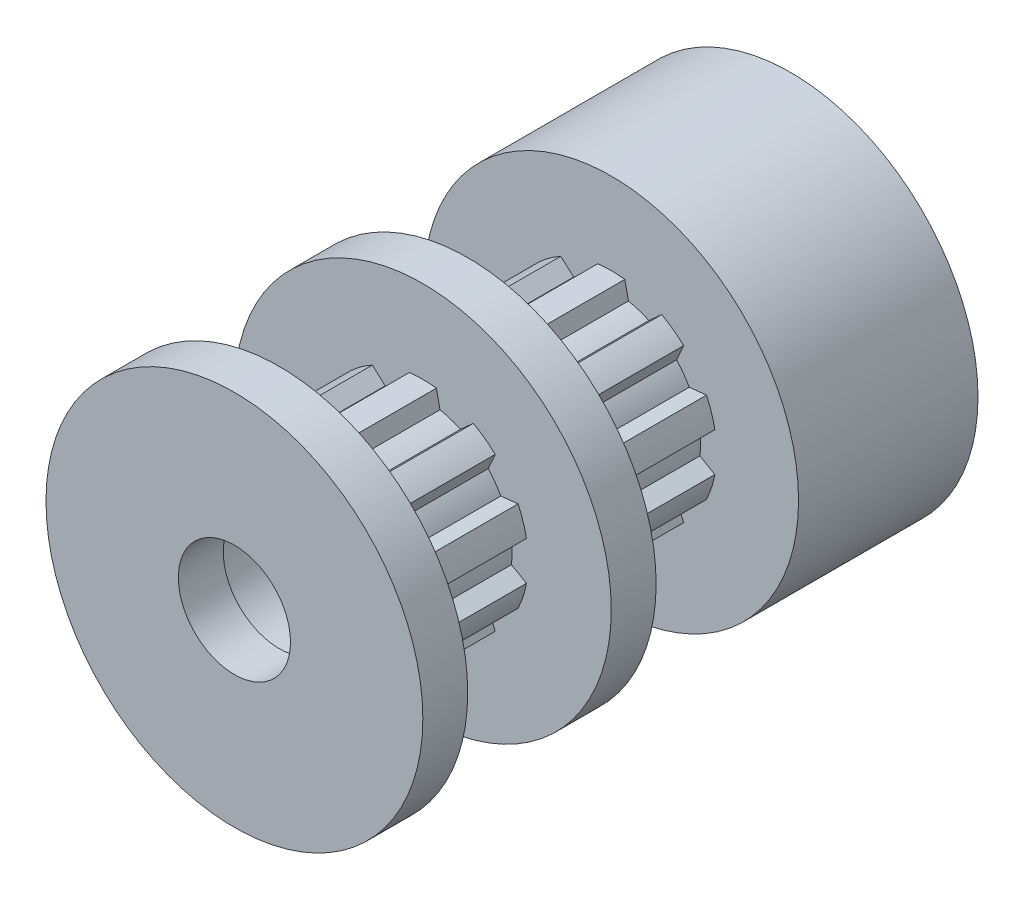
from build123d import *

# Parameters (mm, degrees)
SKETCH1_R           = 1.7653
BOSS_EXTRUDE1_DEPTH = 9.398
SKETCH2_R           = 5.334
SKETCH2_R_2         = 1.5875
BOSS_EXTRUDE2_DEPTH = 1.27
BOSS_EXTRUDE3_START = -1.27
SKETCH3_R           = 5.334
SKETCH3_R_2         = 1.5875
BOSS_EXTRUDE3_DEPTH = 1.27
SKETCH4_R           = 5.302265601
BOSS_EXTRUDE4_DEPTH = 5.08
SKETCH5_R           = 1.016
CUT_EXTRUDE1_DEPTH  = 7.62
SKETCH7_R           = 1.5875
CUT_EXTRUDE3_DEPTH  = 18.461460878


with BuildPart() as part:
    # Sketch1 → Boss-Extrude1 (new body)
    with BuildSketch(Plane.XY.offset(7.9502)):
        with BuildLine():
            Line((-2.508852776, -0.3048), (-2.933400151, -0.549912542))
            ThreePointArc((-2.933400151, -0.549912542), (-2.838428173, -0.92226122), (-2.696401056, -1.279320756))
            Line((-2.696401056, -1.279320756), (-2.208861477, -1.228078282))
            ThreePointArc((-2.208861477, -1.228078282), (-2.04462865, -1.485509668), (-1.850547587, -1.721255042))
            Line((-1.850547587, -1.721255042), (-2.049940092, -2.169097939))
            ThreePointArc((-2.049940092, -2.169097939), (-1.754245085, -2.41451122), (-1.429468404, -2.619897008))
            Line((-1.429468404, -2.619897008), (-1.06516017, -2.291872401))
            ThreePointArc((-1.06516017, -2.291872401), (-0.78097865, -2.403605134), (-0.485396118, -2.480249161))
            Line((-0.485396118, -2.480249161), (-0.383472592, -2.959761649))
            ThreePointArc((-0.383472592, -2.959761649), (0, -2.9845), (0.383472592, -2.959761649))
            Line((0.383472592, -2.959761649), (0.485396118, -2.480249161))
            ThreePointArc((0.485396118, -2.480249161), (0.78097865, -2.403605134), (1.06516017, -2.291872401))
            Line((1.06516017, -2.291872401), (1.429468404, -2.619897008))
            ThreePointArc((1.429468404, -2.619897008), (1.754245085, -2.41451122), (2.049940092, -2.169097939))
            Line((2.049940092, -2.169097939), (1.850547587, -1.721255042))
            ThreePointArc((1.850547587, -1.721255042), (2.04462865, -1.485509668), (2.208861477, -1.228078282))
            Line((2.208861477, -1.228078282), (2.696401056, -1.279320756))
            ThreePointArc((2.696401056, -1.279320756), (2.838428173, -0.92226122), (2.933400151, -0.549912542))
            Line((2.933400151, -0.549912542), (2.508852776, -0.3048))
            ThreePointArc((2.508852776, -0.3048), (2.5273, 0), (2.508852776, 0.3048))
            Line((2.508852776, 0.3048), (2.933400151, 0.549912542))
            ThreePointArc((2.933400151, 0.549912542), (2.838428173, 0.92226122), (2.696401056, 1.279320756))
            Line((2.696401056, 1.279320756), (2.208861477, 1.228078282))
            ThreePointArc((2.208861477, 1.228078282), (2.04462865, 1.485509668), (1.850547587, 1.721255042))
            Line((1.850547587, 1.721255042), (2.049940092, 2.169097939))
            ThreePointArc((2.049940092, 2.169097939), (1.754245085, 2.41451122), (1.429468404, 2.619897008))
            Line((1.429468404, 2.619897008), (1.06516017, 2.291872401))
            ThreePointArc((1.06516017, 2.291872401), (0.78097865, 2.403605134), (0.485396118, 2.480249161))
            Line((0.485396118, 2.480249161), (0.383472592, 2.959761649))
            ThreePointArc((0.383472592, 2.959761649), (0, 2.9845), (-0.383472592, 2.959761649))
            Line((-0.383472592, 2.959761649), (-0.485396118, 2.480249161))
            ThreePointArc((-0.485396118, 2.480249161), (-0.78097865, 2.403605134), (-1.06516017, 2.291872401))
            Line((-1.06516017, 2.291872401), (-1.429468404, 2.619897008))
            ThreePointArc((-1.429468404, 2.619897008), (-1.754245085, 2.41451122), (-2.049940092, 2.169097939))
            Line((-2.049940092, 2.169097939), (-1.850547587, 1.721255042))
            ThreePointArc((-1.850547587, 1.721255042), (-2.04462865, 1.485509668), (-2.208861477, 1.228078282))
            Line((-2.208861477, 1.228078282), (-2.696401056, 1.279320756))
            ThreePointArc((-2.696401056, 1.279320756), (-2.838428173, 0.92226122), (-2.933400151, 0.549912542))
            Line((-2.933400151, 0.549912542), (-2.508852776, 0.3048))
            ThreePointArc((-2.508852776, 0.3048), (-2.5273, 0), (-2.508852776, -0.3048))
        make_face()
        with Locations(Location((0, 0, 0), (0, 0, 180))):
            Circle(SKETCH1_R, mode=Mode.SUBTRACT)
    extrude(amount=-BOSS_EXTRUDE1_DEPTH)

    # Sketch2 → Boss-Extrude2 (add)
    with BuildSketch(Plane.XY.offset(7.9502)):
        Circle(SKETCH2_R)
        Circle(SKETCH2_R_2, mode=Mode.SUBTRACT)
    extrude(amount=BOSS_EXTRUDE2_DEPTH)

    # Sketch3 → Boss-Extrude3 (add)
    with BuildSketch(Plane.XY.offset(3.8862).offset(BOSS_EXTRUDE3_START)):
        Circle(SKETCH3_R)
        Circle(SKETCH3_R_2, mode=Mode.SUBTRACT)
    extrude(amount=BOSS_EXTRUDE3_DEPTH)

    # Sketch4 → Boss-Extrude4 (add)
    with BuildSketch(Plane(origin=(0, 0, -1.4478), x_dir=(-1, 0, 0), z_dir=(0, 0, -1))):
        Circle(SKETCH4_R)
    extrude(amount=BOSS_EXTRUDE4_DEPTH)

    # Sketch5 → Cut-Extrude1 (cut)
    with BuildSketch(Plane(origin=(0, 0, 0), x_dir=(1, 0, 0), z_dir=(0, 1, 0))):
        with Locations(Location((-0.031734399, 3.9878, 0), (0, 0, 270))):
            Circle(SKETCH5_R)
    extrude(amount=-CUT_EXTRUDE1_DEPTH, mode=Mode.SUBTRACT)

    # Sketch7 → Cut-Extrude3 (cut, through all)
    with BuildSketch(Plane(origin=(0, 0, -6.5278), x_dir=(-1, 0, 0), z_dir=(0, 0, -1))):
        with Locations(Location((0, 0, 0), (0, 0, 180))):
            Circle(SKETCH7_R)
    extrude(amount=-CUT_EXTRUDE3_DEPTH, mode=Mode.SUBTRACT)


solid = part.part
